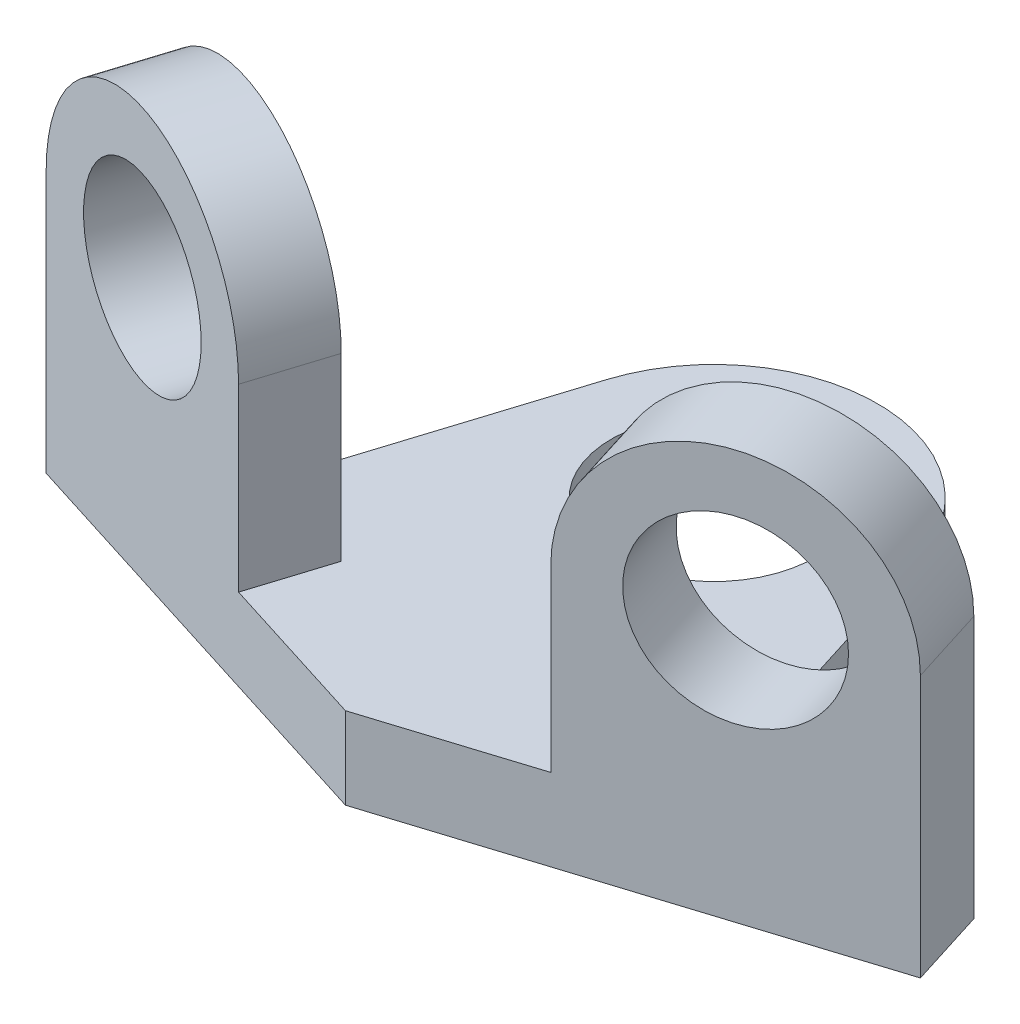
from build123d import *

# Parameters (mm, degrees)
SKETCH1_R           = 12.5
BOSS_EXTRUDE1_DEPTH = 5
SKETCH2_R           = 11
BOSS_EXTRUDE2_DEPTH = 10


with BuildPart() as part:
    # Sketch1 → Boss-Extrude1 (new, symmetric)
    with BuildSketch(Plane(origin=(0, 0, 0), x_dir=(1, 0, 0), z_dir=(0, 1, 0))):
        with BuildLine():
            Line((0, 0), (31.979808833, 10.083194994))
            Line((31.979808833, 10.083194994), (19.074339015, 51.01411599))
            ThreePointArc((19.074339015, 51.01411599), (0, 65), (-19.074339015, 51.01411599))
            Line((-19.074339015, 51.01411599), (-31.979808833, 10.083194994))
            Line((-31.979808833, 10.083194994), (0, 0))
        make_face()
        with Locations(Location((0, 45, 0), (0, 0, 270))):
            Circle(SKETCH1_R, mode=Mode.SUBTRACT)
    extrude(amount=BOSS_EXTRUDE1_DEPTH, both=True)

    # Sketch2 → Boss-Extrude2 (add)
    with BuildSketch(Plane(origin=(0, 0, 0), x_dir=(0.9537169507482279, 0, -0.30070579950427007), z_dir=(0.30070579950427, 0, 0.9537169507482278))):
        with BuildLine():
            Line((20, -5), (20, 27))
            ThreePointArc((20, 27), (38, 45), (56, 27))
            Line((56, 27), (56, -5))
            Line((56, -5), (20, -5))
        make_face()
        with Locations((38, 27)):
            Circle(SKETCH2_R, mode=Mode.SUBTRACT)
    boss_extrude2 = extrude(amount=-BOSS_EXTRUDE2_DEPTH)

    # Mirror2: Boss-Extrude2 across plane
    add(boss_extrude2.mirror(Plane(origin=(0, 0, 0), x_dir=(0, 0, 1), z_dir=(1, 0, 0))))


solid = part.part
